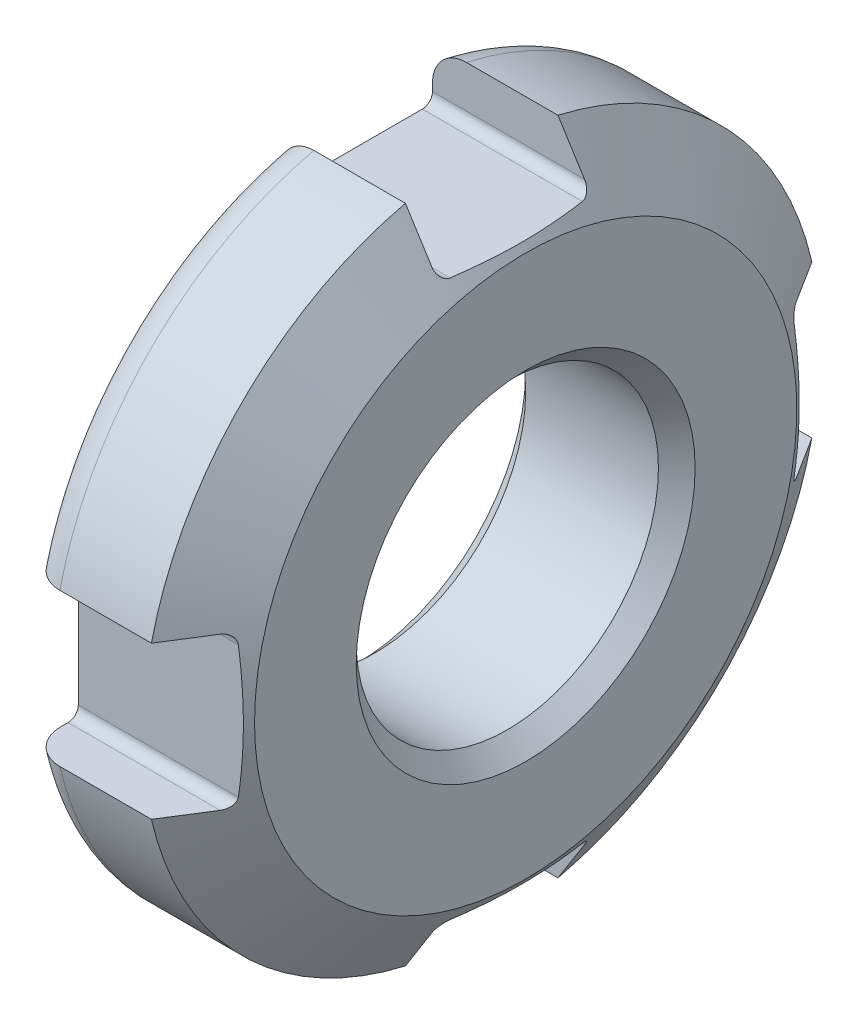
from build123d import *

# Parameters (mm, degrees)
CUT_EXTRUDE1_REACH   = 17
CUT_EXTRUDE2_REACH   = 17
CUT_EXTRUDE3_REACH   = 17
CUT_EXTRUDE4_REACH   = 16.83
M8_CLEARANCE_HOLE1_D = 8.917
CHAMFER1_SIZE        = 0.5415
FILLET1_R            = 0.3
FILLET2_R            = 1


with BuildPart() as part:
    # Sketch1 → Revolve1 (revolve)
    with BuildSketch(Plane(origin=(0, 0, 0), x_dir=(-1, 0, 0), z_dir=(0, 0, -1)), mode=Mode.PRIVATE) as revolve1_sk:
        Polygon((-5, 8), (-5, 0), (0, 0), (0, 10), (-3.701184814, 10), align=None)
    revolve(revolve1_sk.sketch.rotate(Axis((5, 0, 0), (-1, 0, 0)), 270), axis=Axis((5, 0, 0), (-1, 0, 0)))

    # Cut-Extrude1: up to this cone (the profile starts inside it)
    cut_extrude1_end = Plane(origin=(0, 0, 0), z_dir=(-1, 0, 0)).offset(-10.195259746) * Cone(1.54e-06, 66.821801925, 43.394584565, align=(Align.CENTER, Align.CENTER, Align.MIN), mode=Mode.PRIVATE)
    # Sketch2 → Cut-Extrude1 (cut, up to the surface)
    with BuildSketch(Plane.ZY, mode=Mode.PRIVATE) as cut_extrude1_sk1:
        with BuildLine():
            Line((9.743587635, 2.25), (8.2, 2.25))
            Line((8.2, 2.25), (8.2, -2.25))
            Line((8.2, -2.25), (9.743587635, -2.25))
            ThreePointArc((9.743587635, -2.25), (10, 0), (9.743587635, 2.25))
        make_face()
    cut_extrude1_tool1 = extrude(cut_extrude1_sk1.sketch, amount=-CUT_EXTRUDE1_REACH, mode=Mode.PRIVATE) & cut_extrude1_end
    add(cut_extrude1_tool1.solids().sort_by_distance((0, 0, 9.059184))[0], mode=Mode.SUBTRACT)

    # Cut-Extrude2: up to this cone (the profile starts inside it)
    cut_extrude2_end = Plane(origin=(0, 0, 0), z_dir=(-1, 0, 0)).offset(-10.195259746) * Cone(1.54e-06, 66.821801925, 43.394584565, align=(Align.CENTER, Align.CENTER, Align.MIN), mode=Mode.PRIVATE)
    # Sketch3 → Cut-Extrude2 (cut, up to the surface)
    with BuildSketch(Plane.ZY, mode=Mode.PRIVATE) as cut_extrude2_sk1:
        with BuildLine():
            Line((2.25, -9.743587635), (2.25, -8.2))
            Line((2.25, -8.2), (-2.25, -8.2))
            Line((-2.25, -8.2), (-2.25, -9.743587635))
            ThreePointArc((-2.25, -9.743587635), (0, -10), (2.25, -9.743587635))
        make_face()
    cut_extrude2_tool1 = extrude(cut_extrude2_sk1.sketch, amount=-CUT_EXTRUDE2_REACH, mode=Mode.PRIVATE) & cut_extrude2_end
    add(cut_extrude2_tool1.solids().sort_by_distance((0, -9.059184, 0))[0], mode=Mode.SUBTRACT)

    # Cut-Extrude3: up to this cone (the profile starts inside it)
    cut_extrude3_end = Plane(origin=(0, 0, 0), z_dir=(-1, 0, 0)).offset(-10.195259746) * Cone(1.54e-06, 66.821801925, 43.394584565, align=(Align.CENTER, Align.CENTER, Align.MIN), mode=Mode.PRIVATE)
    # Sketch4 → Cut-Extrude3 (cut, up to the surface)
    with BuildSketch(Plane.ZY, mode=Mode.PRIVATE) as cut_extrude3_sk1:
        with BuildLine():
            Line((-9.743587635, -2.25), (-8.2, -2.25))
            Line((-8.2, -2.25), (-8.2, 2.25))
            Line((-8.2, 2.25), (-9.743587635, 2.25))
            ThreePointArc((-9.743587635, 2.25), (-10, 0), (-9.743587635, -2.25))
        make_face()
    cut_extrude3_tool1 = extrude(cut_extrude3_sk1.sketch, amount=-CUT_EXTRUDE3_REACH, mode=Mode.PRIVATE) & cut_extrude3_end
    add(cut_extrude3_tool1.solids().sort_by_distance((0, 0, -9.059184))[0], mode=Mode.SUBTRACT)

    # Cut-Extrude4: up to this cone (the profile starts inside it)
    cut_extrude4_end = Plane(origin=(0, 0, 0), z_dir=(-1, 0, 0)).offset(-10.195259746) * Cone(1.54e-06, 66.560024881, 43.224584565, align=(Align.CENTER, Align.CENTER, Align.MIN), mode=Mode.PRIVATE)
    # Sketch5 → Cut-Extrude4 (cut, up to the surface)
    with BuildSketch(Plane.ZY, mode=Mode.PRIVATE) as cut_extrude4_sk1:
        with BuildLine():
            Line((-2.25, 9.743587635), (-2.25, 8.2))
            Line((-2.25, 8.2), (2.25, 8.2))
            Line((2.25, 8.2), (2.25, 9.743587635))
            ThreePointArc((2.25, 9.743587635), (0, 10), (-2.25, 9.743587635))
        make_face()
    cut_extrude4_tool1 = extrude(cut_extrude4_sk1.sketch, amount=-CUT_EXTRUDE4_REACH, mode=Mode.PRIVATE) & cut_extrude4_end
    add(cut_extrude4_tool1.solids().sort_by_distance((0, 9.059184, 0))[0], mode=Mode.SUBTRACT)

    # M8 Clearance Hole1 (through all)
    with Locations(Plane(origin=(5, 0, 0), x_dir=(0, 0, -1), z_dir=(1, 0, 0))):
        with Locations((0, 0)):
            Hole(M8_CLEARANCE_HOLE1_D / 2)

    # Chamfer1
    chamfer1_edges = [part.edges().sort_by_distance(p)[0] for p in [
        (5, 0, -4.4585),
        (0, 0, -4.4585),
    ]]
    chamfer(chamfer1_edges, length=CHAMFER1_SIZE)

    # Fillet1
    fillet1_edges = [part.edges().sort_by_distance(p)[0] for p in [
        (2.336645522, 8.2, -2.25),
        (2.336645522, 2.25, 8.2),
        (2.336645522, -8.2, 2.25),
        (2.336645522, -2.25, 8.2),
        (2.336645522, 8.2, 2.25),
        (2.336645522, -8.2, -2.25),
        (2.336645522, 2.25, -8.2),
        (2.336645522, -2.25, -8.2),
    ]]
    fillet(fillet1_edges, radius=FILLET1_R)

    # Fillet2
    fillet2_edges = [part.edges().sort_by_distance(p)[0] for p in [
        (0, -7.071067812, 7.071067812),
        (0, -7.071067812, -7.071067812),
        (0, 7.071067812, 7.071067812),
        (0, 7.071067812, -7.071067812),
    ]]
    fillet(fillet2_edges, radius=FILLET2_R)


solid = part.part
